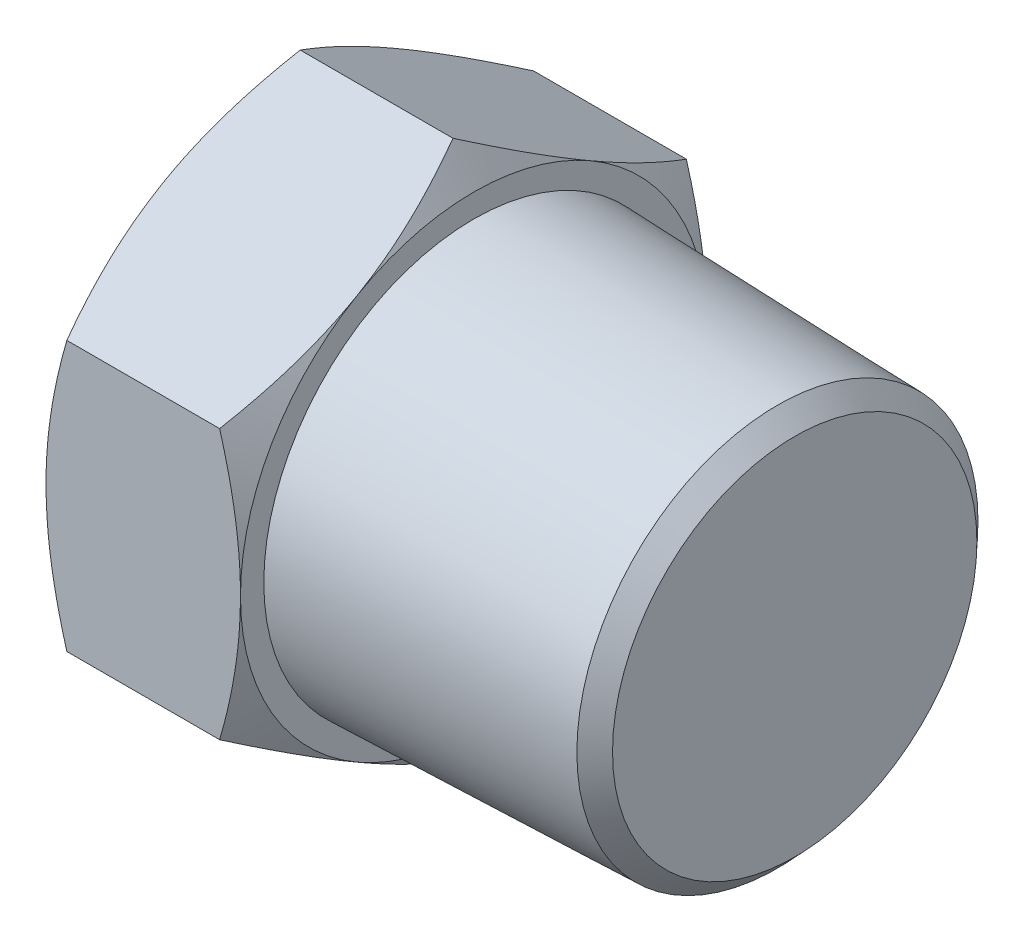
from build123d import *

# Parameters (mm, degrees)
SKETCH2_R          = 8.164727576
EXTRUDE1_DEPTH     = 13.096875
EXTRUDE1_DRAFT     = 1.783333333
EXTRUDE2_DEPTH     = 7.9375
SKETCH7_OUTSIDE_W  = 120.294
SKETCH7_OUTSIDE_H  = 123.242
SKETCH7_OUTSIDE_R  = 9.525
CUT_EXTRUDE1_DEPTH = 26.576122784
CUT_EXTRUDE1_DRAFT = -60
SKETCH8_OUTSIDE_W  = 99.508
SKETCH8_OUTSIDE_H  = 102.456
SKETCH8_OUTSIDE_R  = 9.525
CUT_EXTRUDE2_DEPTH = 20.576037898
CUT_EXTRUDE2_DRAFT = -60
CHAMFER1_SIZE      = 0.705555556
CHAMFER1_SIZE2     = 0.728581919


with BuildPart() as part:
    # Sketch2 → Extrude1 (with draft: the straight prism first)
    with BuildSketch(Plane(origin=(10.5171875, 0, 0), x_dir=(0, 0, -1), z_dir=(1, 0, 0))):
        Circle(SKETCH2_R)
    extrude(amount=-EXTRUDE1_DEPTH)
    # Extrude1: the draft: its side faces are tilted about the plane it starts from
    extrude1_sides = [part.faces().sort_by_distance(p)[0] for p in [
        (3.96875, 0, 8.164727576),
    ]]
    draft(extrude1_sides, Plane(origin=(10.5171875, 0, 0), x_dir=(0, 0, -1), z_dir=(1, 0, 0)), EXTRUDE1_DRAFT)

    # Chamfer1
    chamfer1_edges = [part.edges().sort_by_distance(p)[0] for p in [
        (10.5171875, 0, 8.164727576),
    ]]
    chamfer1_side = [part.faces().sort_by_distance(p)[0] for p in [
        (3.96875, 0, 8.368613788),
    ]]
    chamfer(chamfer1_edges, length=CHAMFER1_SIZE, length2=CHAMFER1_SIZE2, reference=chamfer1_side[0])


with BuildPart() as body_2:
    # Sketch6 → Extrude2 (new body)
    with BuildSketch(Plane.ZY.offset(2.5796875)):
        Polygon((0, 10.998522628), (-9.525, 5.499261314), (-9.525, -5.499261314), (0, -10.998522628), (9.525, -5.499261314), (9.525, 5.499261314), align=None)
    extrude(amount=EXTRUDE2_DEPTH)


with BuildPart() as cut_extrude1_tool:
    # Sketch7 outside → Cut-Extrude1 (with draft: the straight prism first)
    with BuildSketch(Plane.ZY.offset(10.5171875)):
        Rectangle(SKETCH7_OUTSIDE_W, SKETCH7_OUTSIDE_H)
        Circle(SKETCH7_OUTSIDE_R, mode=Mode.SUBTRACT)
    extrude(amount=-CUT_EXTRUDE1_DEPTH)
    # Cut-Extrude1: the draft: its side faces are tilted about the plane it starts from
    cut_extrude1_sides = [cut_extrude1_tool.faces().sort_by_distance(p)[0] for p in [
        (2.770873892, -61.621, 0),
        (2.770873892, 0, 60.147),
        (2.770873892, 61.621, 0),
        (2.770873892, 0, -60.147),
        (2.770873892, 0, -9.525),
    ]]
    draft(cut_extrude1_sides, Plane.ZY.offset(10.5171875), CUT_EXTRUDE1_DRAFT)


with BuildPart() as body_2_1:
    add(body_2.part)

    # Cut-Extrude1: cut by cut_extrude1_tool
    add(cut_extrude1_tool.part, mode=Mode.SUBTRACT)


with BuildPart() as cut_extrude2_tool:
    # Sketch8 outside → Cut-Extrude2 (with draft: the straight prism first)
    with BuildSketch(Plane(origin=(-2.5796875, 0, 0), x_dir=(0, 0, -1), z_dir=(1, 0, 0))):
        Rectangle(SKETCH8_OUTSIDE_W, SKETCH8_OUTSIDE_H)
        Circle(SKETCH8_OUTSIDE_R, mode=Mode.SUBTRACT)
    extrude(amount=-CUT_EXTRUDE2_DEPTH)
    # Cut-Extrude2: the draft: its side faces are tilted about the plane it starts from
    cut_extrude2_sides = [cut_extrude2_tool.faces().sort_by_distance(p)[0] for p in [
        (-12.867706449, -51.228, 0),
        (-12.867706449, 0, -49.754),
        (-12.867706449, 51.228, 0),
        (-12.867706449, 0, 49.754),
        (-12.867706449, 0, 9.525),
    ]]
    draft(cut_extrude2_sides, Plane(origin=(-2.5796875, 0, 0), x_dir=(0, 0, -1), z_dir=(1, 0, 0)), CUT_EXTRUDE2_DRAFT)


with BuildPart() as body_2_2:
    add(body_2_1.part)

    # Cut-Extrude2: cut by cut_extrude2_tool
    add(cut_extrude2_tool.part, mode=Mode.SUBTRACT)


solid = Compound([part.part, body_2_2.part])
